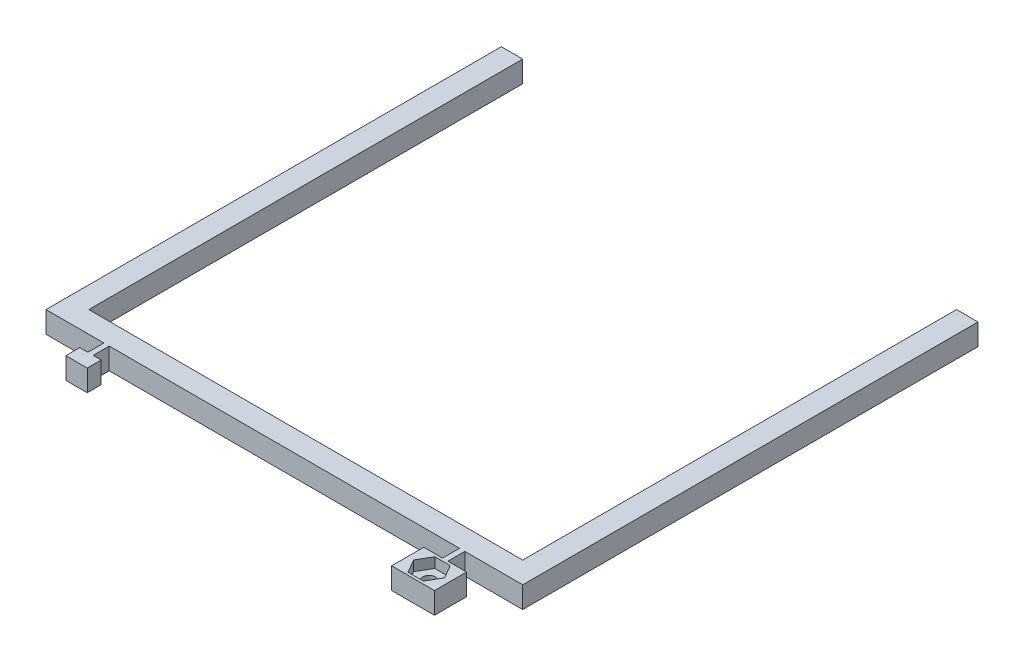
from build123d import *

# Parameters (mm, degrees)
BOSS_EXTRUDE1_DEPTH = 5.08
CUT_EXTRUDE1_DEPTH  = 2.413
SKETCH8_R           = 1.524
CUT_EXTRUDE2_DEPTH  = 2.667


with BuildPart() as part:
    # Sketch1 → Boss-Extrude1 (new body)
    with BuildSketch(Plane(origin=(0, 0, 0), x_dir=(1, 0, 0), z_dir=(0, 1, 0))):
        Polygon((41.520544409, 0), (-41.520544409, 0), (-41.520544409, -3.81), (-39.615544409, -3.81), (-39.615544409, -7.112), (-44.695544409, -7.112), (-44.695544409, -3.81), (-42.790544409, -3.81), (-42.790544409, 0), (-56.515, 0), (-56.515, 107.95), (-51.435, 107.95), (-51.435, 5.08), (51.435, 5.08), (51.435, 107.95), (56.515, 107.95), (56.515, 0), (42.790544409, 0), (42.790544409, -4.019776581), (47.235544409, -4.019776581), (47.235544409, -11.639776581), (37.075544409, -11.639776581), (37.075544409, -4.019776581), (41.520544409, -4.019776581), align=None)
    extrude(amount=BOSS_EXTRUDE1_DEPTH)

    # Sketch2 → Cut-Extrude1 (cut)
    with BuildSketch(Plane(origin=(0, 5.08, 0), x_dir=(1, 0, 0), z_dir=(0, 1, 0))):
        Polygon((40.322457304, -4.654776581), (38.4893702, -7.829776581), (40.322457304, -11.004776581), (43.988631514, -11.004776581), (45.821718619, -7.829776581), (43.988631514, -4.654776581), align=None)
    extrude(amount=-CUT_EXTRUDE1_DEPTH, mode=Mode.SUBTRACT)

    # Sketch8 → Cut-Extrude2 (cut)
    with BuildSketch(Plane(origin=(0, 2.667, 0), x_dir=(1, 0, 0), z_dir=(0, 1, 0))):
        with Locations(Location((42.155544409, -7.829776581, 0), (0, 0, 270))):
            Circle(SKETCH8_R)
    extrude(amount=-CUT_EXTRUDE2_DEPTH, mode=Mode.SUBTRACT)


solid = part.part
